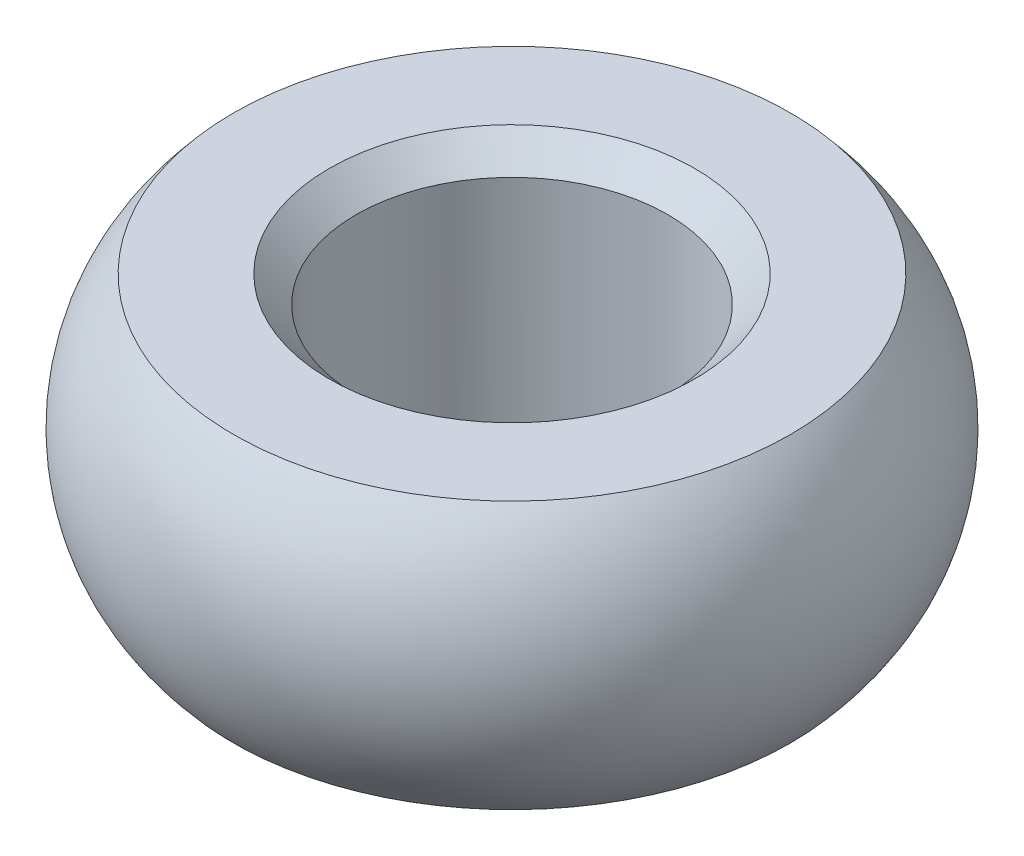
from build123d import *

# Parameters (mm, degrees)
CHAMFER1_SIZE = 3


with BuildPart() as part:
    # Sketch1 → Revolve1 (revolve)
    with BuildSketch(Plane.XY):
        with BuildLine():
            Line((17.5, 15), (17.5, -15))
            Line((17.5, -15), (31.270509831, -15))
            ThreePointArc((31.270509831, -15), (37, 0), (31.270509831, 15))
            Line((31.270509831, 15), (17.5, 15))
        make_face()
    revolve(axis=Axis((0, -562.822725834, 0), (0, 1, 0)))

    # Chamfer1
    chamfer1_edges = [part.edges().sort_by_distance(p)[0] for p in [
        (-17.5, 15, 0),
        (-17.5, -15, 0),
    ]]
    chamfer(chamfer1_edges, length=CHAMFER1_SIZE)


solid = part.part
